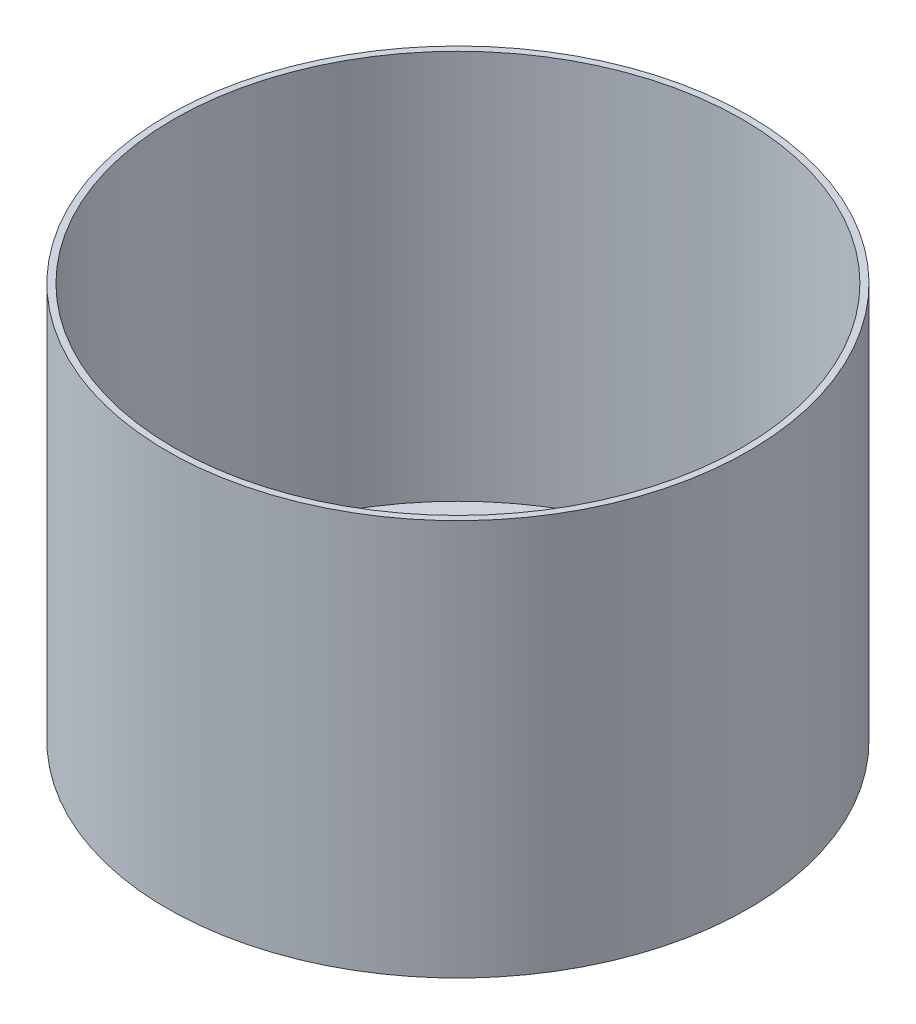
from build123d import *

# Parameters (mm, degrees)
CUT_EXTRUDE2_REACH = 228.224
MOTOR_HOLE_R       = 25.4
MOTOR_HOLE_R_2     = 4.7625


with BuildPart() as part:
    # Compartment → Revolve1 (revolve)
    with BuildSketch(Plane.XY, mode=Mode.PRIVATE) as revolve1_sk:
        Polygon((115.189, -80), (0, -80), (0, -77.46), (112.649, -77.46), (112.649, 76.972), (115.189, 76.972), align=None)
    revolve(revolve1_sk.sketch.rotate(Axis((0, 0, 0), (0, 1, 0)), 90), axis=Axis((0, 0, 0), (0, 1, 0)))

    # Motor Hole → Cut-Extrude2 (cut, up to next)
    with BuildSketch(Plane.XZ.offset(80), mode=Mode.PRIVATE) as cut_extrude2_sk1:
        with Locations(Location((0, 0, 0), (0, 0, 270))):
            Circle(MOTOR_HOLE_R)
    cut_extrude2_tool1 = extrude(cut_extrude2_sk1.sketch, amount=-CUT_EXTRUDE2_REACH, mode=Mode.PRIVATE) & part.part
    # Motor Hole → Cut-Extrude2 (cut, up to next)
    with BuildSketch(Plane.XZ.offset(80), mode=Mode.PRIVATE) as cut_extrude2_sk2:
        with Locations(Location((0, 95.25, 0), (0, 0, 270))):
            Circle(MOTOR_HOLE_R_2)
    cut_extrude2_tool2 = extrude(cut_extrude2_sk2.sketch, amount=-CUT_EXTRUDE2_REACH, mode=Mode.PRIVATE) & part.part
    # Motor Hole → Cut-Extrude2 (cut, up to next)
    with BuildSketch(Plane.XZ.offset(80), mode=Mode.PRIVATE) as cut_extrude2_sk3:
        with Locations(Location((95.25, 0, 0), (0, 0, 270))):
            Circle(MOTOR_HOLE_R_2)
    cut_extrude2_tool3 = extrude(cut_extrude2_sk3.sketch, amount=-CUT_EXTRUDE2_REACH, mode=Mode.PRIVATE) & part.part
    # Motor Hole → Cut-Extrude2 (cut, up to next)
    with BuildSketch(Plane.XZ.offset(80), mode=Mode.PRIVATE) as cut_extrude2_sk4:
        with Locations(Location((0, -95.25, 0), (0, 0, 270))):
            Circle(MOTOR_HOLE_R_2)
    cut_extrude2_tool4 = extrude(cut_extrude2_sk4.sketch, amount=-CUT_EXTRUDE2_REACH, mode=Mode.PRIVATE) & part.part
    # Motor Hole → Cut-Extrude2 (cut, up to next)
    with BuildSketch(Plane.XZ.offset(80), mode=Mode.PRIVATE) as cut_extrude2_sk5:
        with Locations(Location((-95.25, 0, 0), (0, 0, 270))):
            Circle(MOTOR_HOLE_R_2)
    cut_extrude2_tool5 = extrude(cut_extrude2_sk5.sketch, amount=-CUT_EXTRUDE2_REACH, mode=Mode.PRIVATE) & part.part
    add(cut_extrude2_tool1.solids().sort_by_distance((0, -80, 0))[0], mode=Mode.SUBTRACT)
    add(cut_extrude2_tool2.solids().sort_by_distance((0, -80, 95.25))[0], mode=Mode.SUBTRACT)
    add(cut_extrude2_tool3.solids().sort_by_distance((95.25, -80, 0))[0], mode=Mode.SUBTRACT)
    add(cut_extrude2_tool4.solids().sort_by_distance((0, -80, -95.25))[0], mode=Mode.SUBTRACT)
    add(cut_extrude2_tool5.solids().sort_by_distance((-95.25, -80, 0))[0], mode=Mode.SUBTRACT)


solid = part.part
